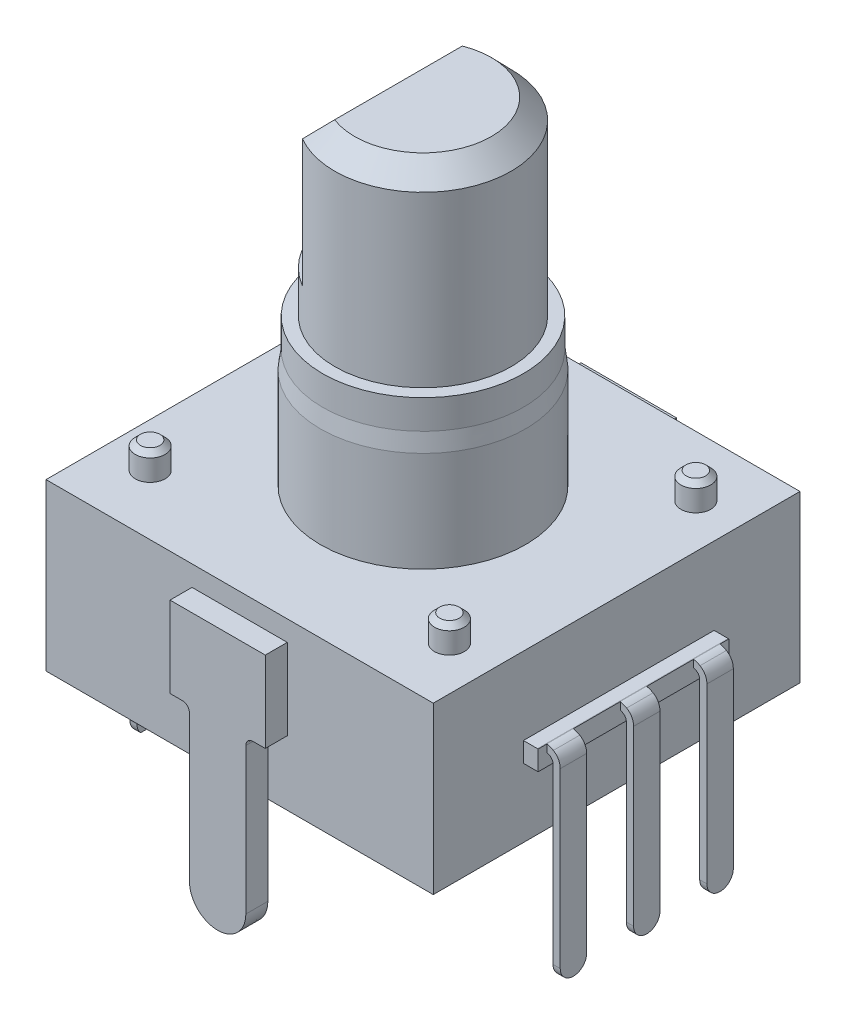
from build123d import *

# Parameters (mm, degrees)
CUT_EXTRUDE1_REACH             = 14.488
SKETCH3_W                      = 1.496007083
SKETCH3_H                      = 5.035144027
CUT_EXTRUDE1_DIRECTION_2_REACH = 14.488
SKETCH4_W                      = 13.2
SKETCH4_H                      = 12.5
BOSS_EXTRUDE1_DEPTH            = 5.652406
CUT_EXTRUDE2_REACH             = 16.633
CUT_EXTRUDE2_DIRECTION_2_REACH = 16.633
SKETCH6_R                      = 0.508
BOSS_EXTRUDE2_DEPTH            = 0.898118
CHAMFER1_SIZE                  = 0.1778
BOSS_EXTRUDE3_DEPTH            = 0.75
BOSS_EXTRUDE6_DEPTH            = 0.762
BOSS_EXTRUDE7_DEPTH            = 0.45
LPATTERN1_COUNT                = 2
LPATTERN1_PITCH                = 2.5
LPATTERN2_COUNT                = 2
LPATTERN2_PITCH                = 2.5
BOSS_EXTRUDE8_DEPTH            = 3.25
BOSS_EXTRUDE9_START            = 2.5
BOSS_EXTRUDE9_DEPTH            = 0.45
LPATTERN3_COUNT                = 2
LPATTERN3_PITCH                = 5
CUT_EXTRUDE5_DEPTH             = 9.525
CUT_EXTRUDE5_DEPTH_BACK        = 7.366


with BuildPart() as part:
    # Sketch2 → Revolve10 (revolve)
    with BuildSketch(Plane.XY, mode=Mode.PRIVATE) as revolve10_sk:
        Polygon((0, 11.468052217), (0, 0), (3.495337225, 0), (3.495337225, 3.417932806), (3.418799831, 4.014804891), (3.418799831, 5.009611631), (3.005617492, 5.009611631), (3.005617492, 10.779335259), (2.332088422, 11.468052217), align=None)
    revolve(revolve10_sk.sketch.rotate(Axis((0, 0, 0), (0, -1, 0)), 90), axis=Axis((0, 0, 0), (0, -1, 0)))

    # Sketch3 → Cut-Extrude1 (cut, up to next)
    with BuildSketch(Plane.XY, mode=Mode.PRIVATE) as cut_extrude1_sk1:
        with Locations((-2.257613951, 8.950480203)):
            Rectangle(SKETCH3_W, SKETCH3_H)
    cut_extrude1_tool1 = extrude(cut_extrude1_sk1.sketch, amount=-CUT_EXTRUDE1_REACH, mode=Mode.PRIVATE) & part.part
    add(cut_extrude1_tool1.solids().sort_by_distance((-2.257614, 8.95048, 0))[0], mode=Mode.SUBTRACT)

    # Sketch3 → Cut-Extrude1 direction 2 (cut, up to next)
    with BuildSketch(Plane.XY, mode=Mode.PRIVATE) as cut_extrude1_direction_2_sk1:
        with Locations((-2.257613951, 8.950480203)):
            Rectangle(SKETCH3_W, SKETCH3_H)
    cut_extrude1_direction_2_tool1 = extrude(cut_extrude1_direction_2_sk1.sketch, amount=CUT_EXTRUDE1_DIRECTION_2_REACH, mode=Mode.PRIVATE) & part.part
    add(cut_extrude1_direction_2_tool1.solids().sort_by_distance((-2.257614, 8.95048, 0))[0], mode=Mode.SUBTRACT)

    # Sketch4 → Boss-Extrude1 (add)
    with BuildSketch(Plane.XZ):
        Rectangle(SKETCH4_W, SKETCH4_H)
    extrude(amount=BOSS_EXTRUDE1_DEPTH)

    # Sketch5 → Cut-Extrude2 (cut, up to next)
    with BuildSketch(Plane.XY, mode=Mode.PRIVATE) as cut_extrude2_sk1:
        Polygon((-1.509610409, 10.779335259), (-0.836200929, 11.468052217), (-1.509610409, 11.468052217), align=None)
    cut_extrude2_tool1 = extrude(cut_extrude2_sk1.sketch, amount=-CUT_EXTRUDE2_REACH, mode=Mode.PRIVATE) & part.part
    add(cut_extrude2_tool1.solids().sort_by_distance((-1.285141, 11.23848, 0))[0], mode=Mode.SUBTRACT)

    # Sketch5 → Cut-Extrude2 direction 2 (cut, up to next)
    with BuildSketch(Plane.XY, mode=Mode.PRIVATE) as cut_extrude2_direction_2_sk1:
        Polygon((-1.509610409, 10.779335259), (-0.836200929, 11.468052217), (-1.509610409, 11.468052217), align=None)
    cut_extrude2_direction_2_tool1 = extrude(cut_extrude2_direction_2_sk1.sketch, amount=CUT_EXTRUDE2_DIRECTION_2_REACH, mode=Mode.PRIVATE) & part.part
    add(cut_extrude2_direction_2_tool1.solids().sort_by_distance((-1.285141, 11.23848, 0))[0], mode=Mode.SUBTRACT)

    # Sketch6 → Boss-Extrude2 (add)
    with BuildSketch(Plane(origin=(0, 0, 0), x_dir=(1, 0, 0), z_dir=(0, 1, 0))):
        with Locations(Location((-5.1, 4.2, 0), (0, 0, 270))):
            Circle(SKETCH6_R)
        with Locations(Location((5.1, 4.2, 0), (0, 0, 270))):
            Circle(SKETCH6_R)
        with Locations(Location((5.1, -4.2, 0), (0, 0, 270))):
            Circle(SKETCH6_R)
        with Locations(Location((-5.1, -4.2, 0), (0, 0, 270))):
            Circle(SKETCH6_R)
    extrude(amount=BOSS_EXTRUDE2_DEPTH)

    # Chamfer1
    chamfer1_edges = [part.edges().sort_by_distance(p)[0] for p in [
        (-5.1, 0.898118, -4.708),
        (5.1, 0.898118, -4.708),
        (5.1, 0.898118, 3.692),
        (-5.1, 0.898118, 3.692),
    ]]
    chamfer(chamfer1_edges, length=CHAMFER1_SIZE)

    # Sketch7 → Boss-Extrude3 (add)
    with BuildSketch(Plane.XY.offset(6.25)):
        with BuildLine():
            Line((-1.623041219, -0.693859314), (-1.623041219, -3.451178736))
            Line((-1.623041219, -3.451178736), (-1.205314472, -3.451178736))
            add(Edge.make_bspline(
                [(-1.205314472, -3.451178736), (-1.070596699, -3.451178736), (-0.96039481, -3.561261035), (-0.96039481, -3.695978808)],
                knots=[27, 27, 27, 27, 28, 28, 28, 28], degree=3))
            Line((-0.96039481, -3.695978808), (-0.96039481, -8.670311484))
            add(Edge.make_bspline(
                [(-0.96039481, -8.670311484), (-0.96039481, -9.200691708), (-0.530290532, -9.630497013), (-8.9692e-05, -9.630497013)],
                knots=[0, 0, 0, 0, 1, 1, 1, 1], degree=3))
            add(Edge.make_bspline(
                [(-8.9692e-05, -9.630497013), (0.530410121, -9.630497013), (0.96039481, -9.200691708), (0.96039481, -8.670311484)],
                knots=[1, 1, 1, 1, 2, 2, 2, 2], degree=3))
            Line((0.96039481, -8.670311484), (0.96039481, -3.695978808))
            add(Edge.make_bspline(
                [(0.96039481, -3.695978808), (0.96039481, -3.561261035), (1.070596699, -3.451178736), (1.205314472, -3.451178736)],
                knots=[3, 3, 3, 3, 4, 4, 4, 4], degree=3))
            Line((1.205314472, -3.451178736), (1.623160808, -3.451178736))
            Line((1.623160808, -3.451178736), (1.623160808, -0.693859314))
            Line((1.623160808, -0.693859314), (-1.623041219, -0.693859314))
        make_face()
    extrude(amount=BOSS_EXTRUDE3_DEPTH)

    # Sketch8 → Boss-Extrude6 (add)
    with BuildSketch(Plane(origin=(0, 0, -6.25), x_dir=(-1, 0, 0), z_dir=(0, 0, -1))):
        with BuildLine():
            Line((1.623041219, -0.693859314), (1.623041219, -3.451178736))
            Line((1.623041219, -3.451178736), (1.205314472, -3.451178736))
            add(Edge.make_bspline(
                [(1.205314472, -3.451178736), (1.070596699, -3.451178736), (0.96039481, -3.561261035), (0.96039481, -3.695978808)],
                knots=[27, 27, 27, 27, 28, 28, 28, 28], degree=3))
            Line((0.96039481, -3.695978808), (0.96039481, -8.670311484))
            add(Edge.make_bspline(
                [(0.96039481, -8.670311484), (0.96039481, -9.200691708), (0.530290532, -9.630497013), (8.9692e-05, -9.630497013)],
                knots=[0, 0, 0, 0, 1, 1, 1, 1], degree=3))
            add(Edge.make_bspline(
                [(8.9692e-05, -9.630497013), (-0.530410121, -9.630497013), (-0.96039481, -9.200691708), (-0.96039481, -8.670311484)],
                knots=[1, 1, 1, 1, 2, 2, 2, 2], degree=3))
            Line((-0.96039481, -8.670311484), (-0.96039481, -3.695978808))
            add(Edge.make_bspline(
                [(-0.96039481, -3.695978808), (-0.96039481, -3.561261035), (-1.070596699, -3.451178736), (-1.205314472, -3.451178736)],
                knots=[3, 3, 3, 3, 4, 4, 4, 4], degree=3))
            Line((-1.205314472, -3.451178736), (-1.623160808, -3.451178736))
            Line((-1.623160808, -3.451178736), (-1.623160808, -0.693859314))
            Line((-1.623160808, -0.693859314), (1.623041219, -0.693859314))
        make_face()
    extrude(amount=BOSS_EXTRUDE6_DEPTH)

    # Sketch11 → Boss-Extrude9 (add, symmetric)
    with BuildSketch(Plane.XY.offset(BOSS_EXTRUDE9_START)):
        with BuildLine():
            Line((-6.550674125, -4.792018211), (-6.743894919, -4.792018211))
            add(Edge.make_bspline(
                [(-6.743894919, -4.792018211), (-6.755233681, -4.793562482), (-6.76875547, -4.797296224), (-6.775024362, -4.802302924)],
                knots=[9.296375668, 9.296375668, 9.296375668, 9.296375668, 10, 10, 10, 10], degree=3))
            add(Edge.make_bspline(
                [(-6.775024362, -4.802302924), (-6.782259538, -4.810255637), (-6.797327837, -4.813185584), (-6.799899015, -4.884939391)],
                knots=[10, 10, 10, 10, 11, 11, 11, 11], degree=3))
            add(Edge.make_bspline(
                [(-6.799899015, -4.884939391), (-6.799899015, -5.12537444), (-6.799899015, -9.280517818), (-6.799659836, -9.284942637)],
                knots=[11, 11, 11, 11, 12, 12, 12, 12], degree=3))
            Line((-6.799659836, -9.284942637), (-7.044818677, -9.284942637))
            add(Edge.make_bspline(
                [(-7.044818677, -9.284942637), (-7.044818677, -9.284703457), (-7.044818677, -5.12537444), (-7.044818677, -4.884939391)],
                knots=[0, 0, 0, 0, 1, 1, 1, 1], degree=3))
            add(Edge.make_bspline(
                [(-7.044818677, -4.884939391), (-7.047389855, -4.757576384), (-6.991421885, -4.652277672), (-6.91536285, -4.602050007)],
                knots=[1, 1, 1, 1, 2, 2, 2, 2], degree=3))
            add(Edge.make_bspline(
                [(-6.91536285, -4.602050007), (-6.841157454, -4.551104804), (-6.769403647, -4.54697896), (-6.731433924, -4.546500601)],
                knots=[2, 2, 2, 2, 3, 3, 3, 3], degree=3))
            ThreePointArc((-6.731433924, -4.546500601), (-6.720844244, -4.54668254), (-6.710266551, -4.547218139))
            Line((-6.710266551, -4.547218139), (-6.550674125, -4.547218139))
            Line((-6.550674125, -4.547218139), (-6.550674125, -4.792018211))
        make_face()
    boss_extrude9 = extrude(amount=BOSS_EXTRUDE9_DEPTH, both=True)

    # LPattern3: Boss-Extrude9 ×2
    with Locations(*[(0, 0, -i * LPATTERN3_PITCH) for i in range(1, LPATTERN3_COUNT)]):
        add(boss_extrude9)


with BuildPart() as body_2:
    # Sketch9 → Boss-Extrude7 (new, symmetric)
    with BuildSketch(Plane.XY):
        with BuildLine():
            Line((7.627937949, -9.422351177), (7.382898698, -9.422351177))
            add(Edge.make_bspline(
                [(7.382898698, -9.422351177), (7.382659519, -9.422351177), (7.382659519, -3.407827478), (7.382898698, -3.071062943)],
                knots=[0, 0, 0, 0, 1, 1, 1, 1], degree=3))
            add(Edge.make_bspline(
                [(7.382898698, -3.071062943), (7.382898698, -2.896581602), (7.25738933, -2.847729219), (7.174154914, -2.818429747)],
                knots=[1, 1, 1, 1, 2, 2, 2, 2], degree=3))
            add(Edge.make_bspline(
                [(7.174154914, -2.818429747), (7.159684563, -2.814303903), (7.14963903, -2.812091494), (7.143779136, -2.810955392)],
                knots=[2, 2, 2, 2, 3, 3, 3, 3], degree=3))
            Line((7.143779136, -2.810955392), (6.673253546, -2.810955392))
            Line((6.673253546, -2.810955392), (6.673253546, -2.565916141))
            Line((6.673253546, -2.565916141), (7.153166926, -2.565916141))
            Line((7.153166926, -2.565916141), (7.169012558, -2.567052243))
            add(Edge.make_bspline(
                [(7.169012558, -2.567052243), (7.178400348, -2.568846088), (7.280051574, -2.58122362), (7.392824641, -2.648851583)],
                knots=[7, 7, 7, 7, 8, 8, 8, 8], degree=3))
            add(Edge.make_bspline(
                [(7.392824641, -2.648851583), (7.50499976, -2.713489805), (7.630150358, -2.856758239), (7.62757918, -3.071062943)],
                knots=[8, 8, 8, 8, 9, 9, 9, 9], degree=3))
            add(Edge.make_bspline(
                [(7.62757918, -3.071062943), (7.62757918, -3.407588298), (7.62757918, -9.422351177), (7.627937949, -9.422351177)],
                knots=[9, 9, 9, 9, 10, 10, 10, 10], degree=3))
        make_face()
    boss_extrude7 = extrude(amount=BOSS_EXTRUDE7_DEPTH, both=True)



with BuildPart() as lpattern1_1:
    # LPattern1: Boss-Extrude7 ×2
    with Locations(*[(0, 0, -i * LPATTERN1_PITCH) for i in range(1, LPATTERN1_COUNT)]):
        add(boss_extrude7)


with BuildPart() as lpattern2_1:
    # LPattern2: Boss-Extrude7 ×2
    with Locations(*[(0, 0, i * LPATTERN2_PITCH) for i in range(1, LPATTERN2_COUNT)]):
        add(boss_extrude7)


with BuildPart() as body_2_1:
    add(body_2.part)

    add(lpattern1_1.part)  # Boss-Extrude8 merges LPattern1_1

    add(lpattern2_1.part)  # Boss-Extrude8 merges LPattern2_1
    # Sketch10 → Boss-Extrude8 (add, symmetric)
    with BuildSketch(Plane.XY):
        with BuildLine():
            Line((7.174154914, -3.23944521), (6.673253546, -3.23944521))
            Line((6.673253546, -3.23944521), (6.673253546, -2.565916141))
            Line((6.673253546, -2.565916141), (7.153166926, -2.565916141))
            Line((7.153166926, -2.565916141), (7.169012558, -2.567052243))
            add(Edge.make_bspline(
                [(7.169012558, -2.567052243), (7.169908976, -2.567223533), (7.171646644, -2.567491325), (7.174154914, -2.567894506)],
                knots=[7, 7, 7, 7, 7.095487699, 7.095487699, 7.095487699, 7.095487699], degree=3))
            Line((7.174154914, -2.567894506), (7.174154914, -3.23944521))
        make_face()
    extrude(amount=BOSS_EXTRUDE8_DEPTH, both=True)


with BuildPart() as cut_extrude5_tool:
    # Sketch12 → Cut-Extrude5 (new, two sides: drawn at the far end of the back side and taken through both)
    with BuildSketch(Plane(origin=(0, 0, 0), x_dir=(0, 0, -1), z_dir=(1, 0, 0)).offset(-CUT_EXTRUDE5_DEPTH_BACK)):
        with BuildLine():
            Line((-2.95, -8.972351177), (-2.95, -9.549351177))
            Line((-2.95, -9.549351177), (-2.05, -9.549351177))
            Line((-2.05, -9.549351177), (-2.05, -8.972351177))
            ThreePointArc((-2.05, -8.972351177), (-2.5, -9.422351177), (-2.95, -8.972351177))
        make_face()
        with BuildLine():
            Line((-0.45, -8.972351177), (-0.45, -9.549351177))
            Line((-0.45, -9.549351177), (0.45, -9.549351177))
            Line((0.45, -9.549351177), (0.45, -8.972351177))
            ThreePointArc((0.45, -8.972351177), (0, -9.422351177), (-0.45, -8.972351177))
        make_face()
        with BuildLine():
            Line((2.05, -8.972351177), (2.05, -9.549351177))
            Line((2.05, -9.549351177), (2.95, -9.549351177))
            Line((2.95, -9.549351177), (2.95, -8.972351177))
            ThreePointArc((2.95, -8.972351177), (2.5, -9.422351177), (2.05, -8.972351177))
        make_face()
    extrude(amount=CUT_EXTRUDE5_DEPTH + CUT_EXTRUDE5_DEPTH_BACK)


with BuildPart() as part_1:
    add(part.part)

    # Cut-Extrude5: cut by cut_extrude5_tool
    add(cut_extrude5_tool.part, mode=Mode.SUBTRACT)


with BuildPart() as body_2_2:
    add(body_2_1.part)

    # Cut-Extrude5: cut by cut_extrude5_tool
    add(cut_extrude5_tool.part, mode=Mode.SUBTRACT)


solid = Compound([part_1.part, body_2_2.part])
